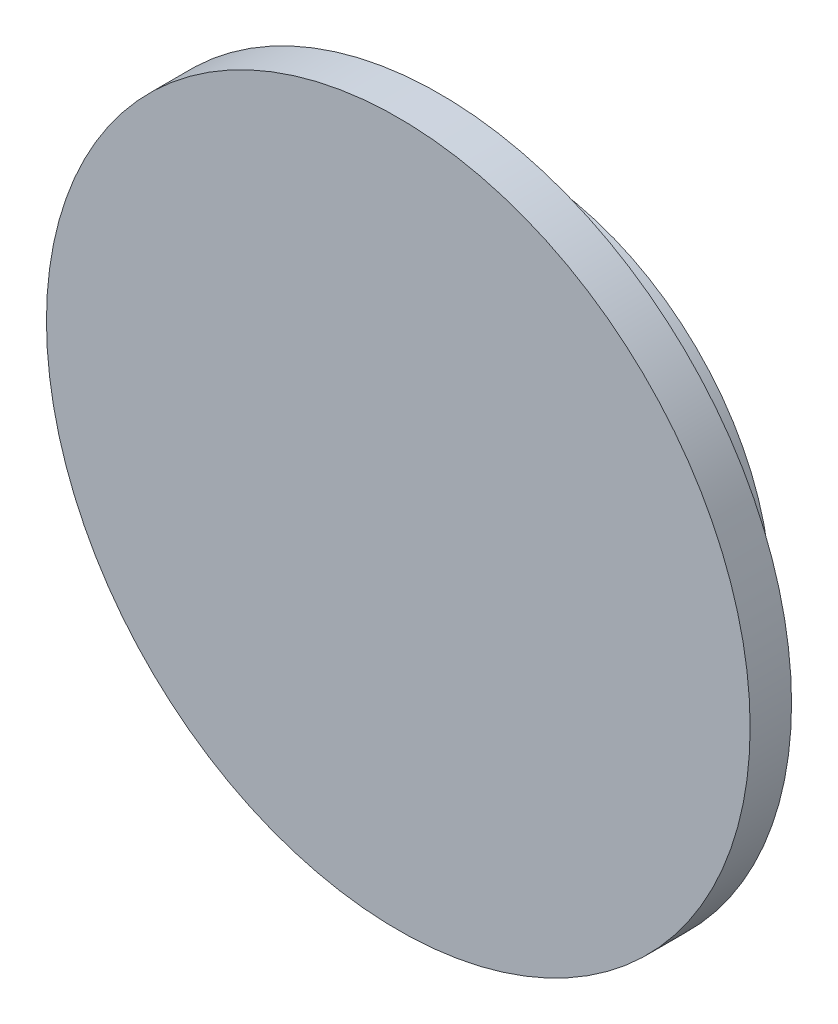
from build123d import *

# Parameters (mm, degrees)
ESBO_O1_R                = 30
RESSALTO_EXTRUS_O1_DEPTH = 10
ESBO_O2_R                = 42.5
RESSALTO_EXTRUS_O2_DEPTH = 5


with BuildPart() as part:
    # Esboço1 → Ressalto-extrusão1 (new body)
    with BuildSketch(Plane.XY):
        with Locations((-200, -240)):
            Circle(ESBO_O1_R)
    extrude(amount=-RESSALTO_EXTRUS_O1_DEPTH)

    # Esboço2 → Ressalto-extrusão2 (add)
    with BuildSketch(Plane.XY):
        with Locations((-200, -240)):
            Circle(ESBO_O2_R)
    extrude(amount=RESSALTO_EXTRUS_O2_DEPTH)


solid = part.part
